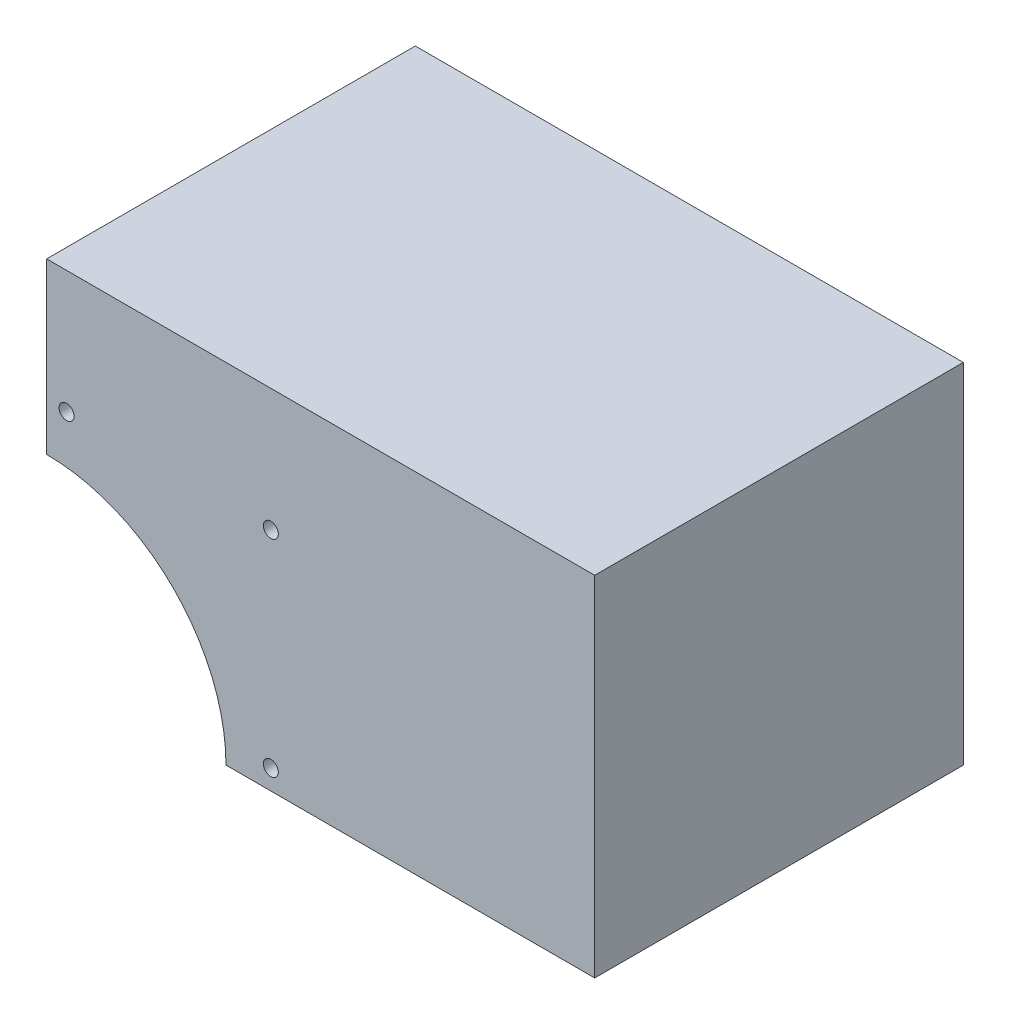
from build123d import *

# Parameters (mm, degrees)
SKETCH_1_W          = 55
SKETCH_1_H          = 35
EXTRUDE_1_DEPTH     = 37
SKETCH_3_W          = 26
SKETCH_3_H          = 32
CUT_EXTRUDE_1_DEPTH = 32
CUT_EXTRUDE_2_REACH = 76.96
SKETCH_4_R          = 0.75
CUT_EXTRUDE_3_REACH = 76.96
SKETCH_5_R          = 0.75
SKETCH_6_W          = 17
SKETCH_6_H          = 1.5
CUT_EXTRUDE_4_DEPTH = 27
SKETCH_7_R          = 18
CUT_EXTRUDE_5_DEPTH = 75.959989328


with BuildPart() as part:
    # 草图1 → 凸台-拉伸1 (new body)
    with BuildSketch(Plane.XY):
        with Locations((27.5, 17.5)):
            Rectangle(SKETCH_1_W, SKETCH_1_H)
    extrude(amount=EXTRUDE_1_DEPTH)

    # 草图3 → 切除-拉伸1 (cut)
    with BuildSketch(Plane.XZ):
        with Locations((13, 18.5)):
            Rectangle(SKETCH_3_W, SKETCH_3_H)
    extrude(amount=-CUT_EXTRUDE_1_DEPTH, mode=Mode.SUBTRACT)

    # 草图4 → 切除-拉伸2 (cut, up to next)
    with BuildSketch(Plane.XY.offset(37), mode=Mode.PRIVATE) as cut_extrude_2_sk1:
        with Locations((2, 2)):
            Circle(SKETCH_4_R)
    cut_extrude_2_tool1 = extrude(cut_extrude_2_sk1.sketch, amount=-CUT_EXTRUDE_2_REACH, mode=Mode.PRIVATE) & part.part
    # 草图4 → 切除-拉伸2 (cut, up to next)
    with BuildSketch(Plane.XY.offset(37), mode=Mode.PRIVATE) as cut_extrude_2_sk2:
        with Locations((22.5, 2)):
            Circle(SKETCH_4_R)
    cut_extrude_2_tool2 = extrude(cut_extrude_2_sk2.sketch, amount=-CUT_EXTRUDE_2_REACH, mode=Mode.PRIVATE) & part.part
    # 草图4 → 切除-拉伸2 (cut, up to next)
    with BuildSketch(Plane.XY.offset(37), mode=Mode.PRIVATE) as cut_extrude_2_sk3:
        with Locations((22.5, 22.7)):
            Circle(SKETCH_4_R)
    cut_extrude_2_tool3 = extrude(cut_extrude_2_sk3.sketch, amount=-CUT_EXTRUDE_2_REACH, mode=Mode.PRIVATE) & part.part
    # 草图4 → 切除-拉伸2 (cut, up to next)
    with BuildSketch(Plane.XY.offset(37), mode=Mode.PRIVATE) as cut_extrude_2_sk4:
        with Locations((2, 22.7)):
            Circle(SKETCH_4_R)
    cut_extrude_2_tool4 = extrude(cut_extrude_2_sk4.sketch, amount=-CUT_EXTRUDE_2_REACH, mode=Mode.PRIVATE) & part.part
    add(cut_extrude_2_tool1.solids().sort_by_distance((2, 2, 37))[0], mode=Mode.SUBTRACT)
    add(cut_extrude_2_tool2.solids().sort_by_distance((22.5, 2, 37))[0], mode=Mode.SUBTRACT)
    add(cut_extrude_2_tool3.solids().sort_by_distance((22.5, 22.7, 37))[0], mode=Mode.SUBTRACT)
    add(cut_extrude_2_tool4.solids().sort_by_distance((2, 22.7, 37))[0], mode=Mode.SUBTRACT)

    # 草图5 → 切除-拉伸3 (cut, up to next)
    with BuildSketch(Plane(origin=(0, 0, 0), x_dir=(-1, 0, 0), z_dir=(0, 0, -1)), mode=Mode.PRIVATE) as cut_extrude_3_sk1:
        with Locations(Location((-22.5, 2, 0), (0, 0, 180))):
            Circle(SKETCH_5_R)
    cut_extrude_3_tool1 = extrude(cut_extrude_3_sk1.sketch, amount=-CUT_EXTRUDE_3_REACH, mode=Mode.PRIVATE) & part.part
    # 草图5 → 切除-拉伸3 (cut, up to next)
    with BuildSketch(Plane(origin=(0, 0, 0), x_dir=(-1, 0, 0), z_dir=(0, 0, -1)), mode=Mode.PRIVATE) as cut_extrude_3_sk2:
        with Locations(Location((-2, 2, 0), (0, 0, 180))):
            Circle(SKETCH_5_R)
    cut_extrude_3_tool2 = extrude(cut_extrude_3_sk2.sketch, amount=-CUT_EXTRUDE_3_REACH, mode=Mode.PRIVATE) & part.part
    # 草图5 → 切除-拉伸3 (cut, up to next)
    with BuildSketch(Plane(origin=(0, 0, 0), x_dir=(-1, 0, 0), z_dir=(0, 0, -1)), mode=Mode.PRIVATE) as cut_extrude_3_sk3:
        with Locations((-2, 26.45)):
            Circle(SKETCH_5_R)
    cut_extrude_3_tool3 = extrude(cut_extrude_3_sk3.sketch, amount=-CUT_EXTRUDE_3_REACH, mode=Mode.PRIVATE) & part.part
    # 草图5 → 切除-拉伸3 (cut, up to next)
    with BuildSketch(Plane(origin=(0, 0, 0), x_dir=(-1, 0, 0), z_dir=(0, 0, -1)), mode=Mode.PRIVATE) as cut_extrude_3_sk4:
        with Locations((-22.5, 26.45)):
            Circle(SKETCH_5_R)
    cut_extrude_3_tool4 = extrude(cut_extrude_3_sk4.sketch, amount=-CUT_EXTRUDE_3_REACH, mode=Mode.PRIVATE) & part.part
    add(cut_extrude_3_tool1.solids().sort_by_distance((22.5, 2, 0))[0], mode=Mode.SUBTRACT)
    add(cut_extrude_3_tool2.solids().sort_by_distance((2, 2, 0))[0], mode=Mode.SUBTRACT)
    add(cut_extrude_3_tool3.solids().sort_by_distance((2, 26.45, 0))[0], mode=Mode.SUBTRACT)
    add(cut_extrude_3_tool4.solids().sort_by_distance((22.5, 26.45, 0))[0], mode=Mode.SUBTRACT)

    # 草图6 → 切除-拉伸4 (cut)
    with BuildSketch(Plane.XZ):
        with Locations((12.25, 35.25)):
            Rectangle(SKETCH_6_W, SKETCH_6_H)
    extrude(amount=-CUT_EXTRUDE_4_DEPTH, mode=Mode.SUBTRACT)

    # 草图7 → 切除-拉伸5 (cut, through all)
    with BuildSketch(Plane.XY.offset(37)):
        Circle(SKETCH_7_R)
    extrude(amount=-CUT_EXTRUDE_5_DEPTH, mode=Mode.SUBTRACT)


solid = part.part
